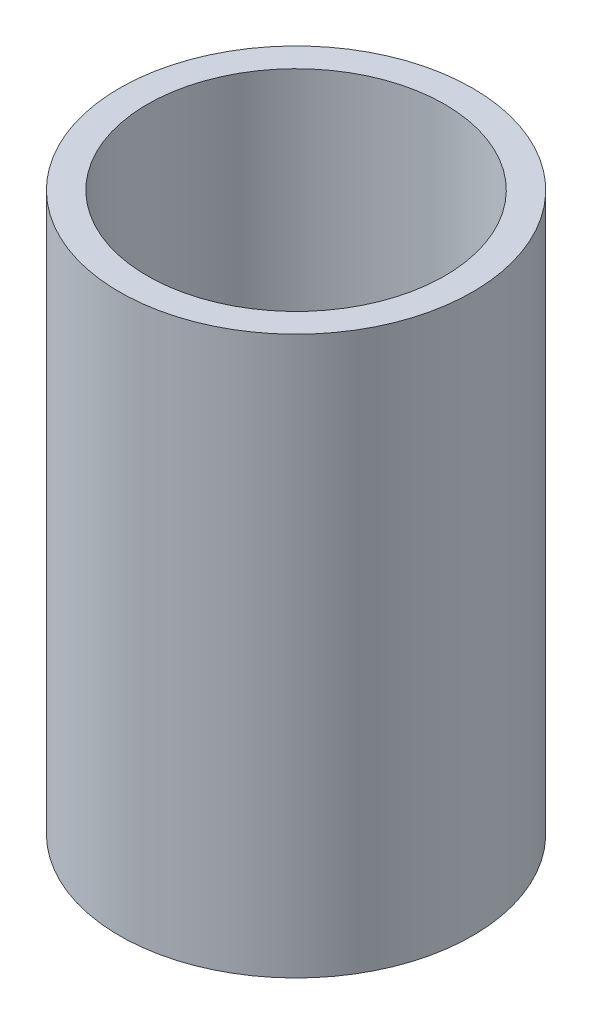
from build123d import *

# Parameters (mm, degrees)
SKETCH1_R           = 24.13
BOSS_EXTRUDE1_DEPTH = 76.2
SKETCH2_R           = 20.32
CUT_EXTRUDE1_DEPTH  = 84.492237963


with BuildPart() as part:
    # Sketch1 → Boss-Extrude1 (new body)
    with BuildSketch(Plane(origin=(0, 0, 0), x_dir=(1, 0, 0), z_dir=(0, 1, 0))):
        with Locations(Location((0, 0, 0), (0, 0, 90))):
            Circle(SKETCH1_R)
    extrude(amount=BOSS_EXTRUDE1_DEPTH)

    # Sketch2 → Cut-Extrude1 (cut, through all)
    with BuildSketch(Plane(origin=(0, 0, 0), x_dir=(-1, 0, 0), z_dir=(0, -1, 0))):
        with Locations(Location((0, 0, 0), (0, 0, 90))):
            Circle(SKETCH2_R)
    extrude(amount=-CUT_EXTRUDE1_DEPTH, mode=Mode.SUBTRACT)


solid = part.part
